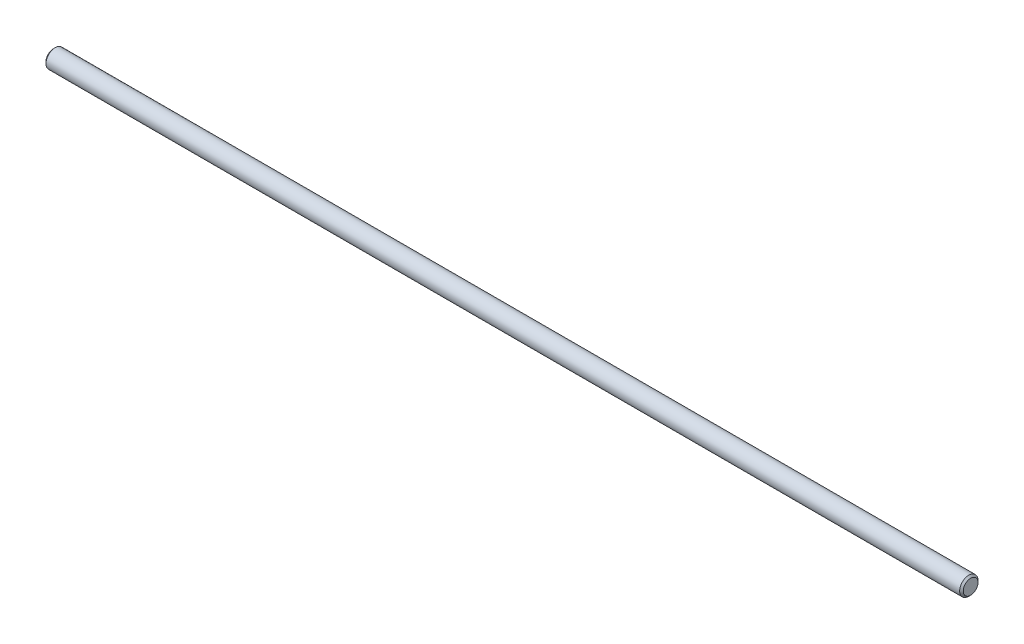
from build123d import *


with BuildPart() as part:
    # Sketch1 → Revolve1 (revolve)
    with BuildSketch(Plane.XY, mode=Mode.PRIVATE) as revolve1_sk:
        Polygon((0, 0), (0, 2.01), (0.49, 2.5), (249.51, 2.5), (250, 2.01), (250, 0), align=None)
    revolve(revolve1_sk.sketch.rotate(Axis((0, 0, 0), (1, 0, 0)), 90), axis=Axis((0, 0, 0), (1, 0, 0)))


solid = part.part
